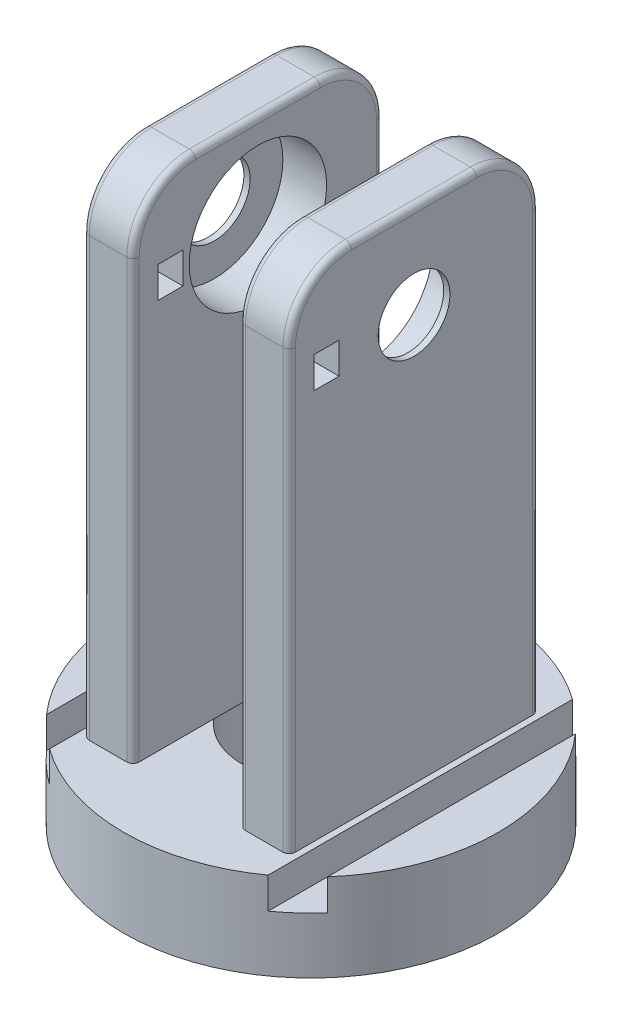
from build123d import *

# Parameters (mm, degrees)
SKETCH1_R               = 30
BOSS_EXTRUDE1_DEPTH     = 14
SKETCH2_R               = 11.05
CUT_EXTRUDE1_DEPTH      = 45.676615807
SKETCH5_W               = 8
SKETCH5_H               = 40
BOSS_EXTRUDE2_DEPTH     = 80
FILLET1_R               = 10
CUT_EXTRUDE5_DEPTH      = 15.5
CUT_EXTRUDE5_DEPTH_BACK = 15.5
SKETCH12_R              = 11
CUT_EXTRUDE6_REACH      = 111.079
SKETCH13_R              = 5.75
SKETCH14_W              = 5
SKETCH14_H              = 60.1
CUT_EXTRUDE7_DEPTH      = 5
FILLET2_R               = 1
FILLET3_R               = 1
CUT_EXTRUDE14_REACH     = 111.079
SKETCH15_W              = 4
SKETCH15_H              = 5


with BuildPart() as part:
    # Sketch1 → Boss-Extrude1 (new body)
    with BuildSketch(Plane(origin=(0, 0, 0), x_dir=(1, 0, 0), z_dir=(0, 1, 0))):
        with Locations(Location((0, 0, 0), (0, 0, 90))):
            Circle(SKETCH1_R)
    extrude(amount=BOSS_EXTRUDE1_DEPTH)

    # Sketch2 → Cut-Extrude1 (cut, through all)
    with BuildSketch(Plane.XZ):
        with Locations(Location((0, 0, 0), (0, 0, 270))):
            Circle(SKETCH2_R)
    extrude(amount=-CUT_EXTRUDE1_DEPTH, mode=Mode.SUBTRACT)

    # Sketch5 → Boss-Extrude2 (add)
    with BuildSketch(Plane(origin=(0, 14, 0), x_dir=(1, 0, 0), z_dir=(0, 1, 0))):
        with Locations((-12.5, 0)):
            Rectangle(SKETCH5_W, SKETCH5_H)
        with Locations((12.5, 0)):
            Rectangle(SKETCH5_W, SKETCH5_H)
    extrude(amount=BOSS_EXTRUDE2_DEPTH)

    # Fillet1
    fillet1_edges = [part.edges().sort_by_distance(p)[0] for p in [
        (-12.5, 94, 20),
        (-12.5, 94, -20),
        (12.5, 94, 20),
        (12.5, 94, -20),
    ]]
    fillet(fillet1_edges, radius=FILLET1_R)

    # Sketch12 → Cut-Extrude5 (cut, two sides: drawn at the far end of the back side and taken through both)
    with BuildSketch(Plane(origin=(0, 0, 0), x_dir=(0, 0, -1), z_dir=(1, 0, 0)).offset(-CUT_EXTRUDE5_DEPTH_BACK)):
        with Locations((0, 79)):
            Circle(SKETCH12_R)
    extrude(amount=CUT_EXTRUDE5_DEPTH + CUT_EXTRUDE5_DEPTH_BACK, mode=Mode.SUBTRACT)

    # Cut-Extrude6: up to this face of the body (flat: up to its plane)
    cut_extrude6_end = Plane(part.part.faces().sort_by_distance((16.5, 53.48656843, 0))[0])
    # Sketch13 → Cut-Extrude6 (cut, up to the picked face)
    with BuildSketch(Plane.ZY.offset(16.5), mode=Mode.PRIVATE) as cut_extrude6_sk1:
        with Locations((0, 79)):
            Circle(SKETCH13_R)
    cut_extrude6_tool1 = split(extrude(cut_extrude6_sk1.sketch, amount=-CUT_EXTRUDE6_REACH, mode=Mode.PRIVATE), bisect_by=cut_extrude6_end, keep=Keep.BOTH, mode=Mode.PRIVATE)
    add(cut_extrude6_tool1.solids().sort_by(Axis((-16.5, 79, 0), (1, 0, 0)))[0], mode=Mode.SUBTRACT)

    # Sketch14 → Cut-Extrude7 (cut)
    with BuildSketch(Plane(origin=(0, 14, 0), x_dir=(1, 0, 0), z_dir=(0, 1, 0))):
        with Locations((-20, 0)):
            Rectangle(SKETCH14_W, SKETCH14_H)
        with Locations((20, 0)):
            Rectangle(SKETCH14_W, SKETCH14_H)
    extrude(amount=-CUT_EXTRUDE7_DEPTH, mode=Mode.SUBTRACT)

    # Fillet2
    fillet2_edges = [part.edges().sort_by_distance(p)[0] for p in [
        (-16.5, 94, 0),
        (-16.5, 49, 20),
        (-16.5, 49, -20),
        (-16.5, 91.071067812, 17.071067812),
        (-16.5, 91.071067812, -17.071067812),
        (16.5, 94, 0),
        (16.5, 49, -20),
        (16.5, 49, 20),
        (16.5, 91.071067812, 17.071067812),
        (16.5, 91.071067812, -17.071067812),
    ]]
    fillet(fillet2_edges, radius=FILLET2_R)

    # Fillet3
    fillet3_edges = [part.edges().sort_by_distance(p)[0] for p in [
        (-8.5, 94, 0),
        (-8.5, 49, -20),
        (-8.5, 49, 20),
        (-8.5, 91.071067812, 17.071067812),
        (-8.5, 91.071067812, -17.071067812),
        (8.5, 94, 0),
        (8.5, 49, 20),
        (8.5, 49, -20),
        (8.5, 91.071067812, 17.071067812),
        (8.5, 91.071067812, -17.071067812),
    ]]
    fillet(fillet3_edges, radius=FILLET3_R)

    # Cut-Extrude14: up to this face of the body (flat: up to its plane)
    cut_extrude14_end = Plane(part.part.faces().sort_by_distance((-16.5, 52.119804327, 0))[0])
    # Sketch15 → Cut-Extrude14 (cut, up to the picked face)
    with BuildSketch(Plane(origin=(16.5, 0, 0), x_dir=(0, 0, -1), z_dir=(1, 0, 0)), mode=Mode.PRIVATE) as cut_extrude14_sk1:
        with Locations((-14, 79)):
            Rectangle(SKETCH15_W, SKETCH15_H)
    cut_extrude14_tool1 = split(extrude(cut_extrude14_sk1.sketch, amount=-CUT_EXTRUDE14_REACH, mode=Mode.PRIVATE), bisect_by=cut_extrude14_end, keep=Keep.BOTH, mode=Mode.PRIVATE)
    add(cut_extrude14_tool1.solids().sort_by(Axis((16.5, 79, 14), (-1, 0, 0)))[0], mode=Mode.SUBTRACT)


solid = part.part
